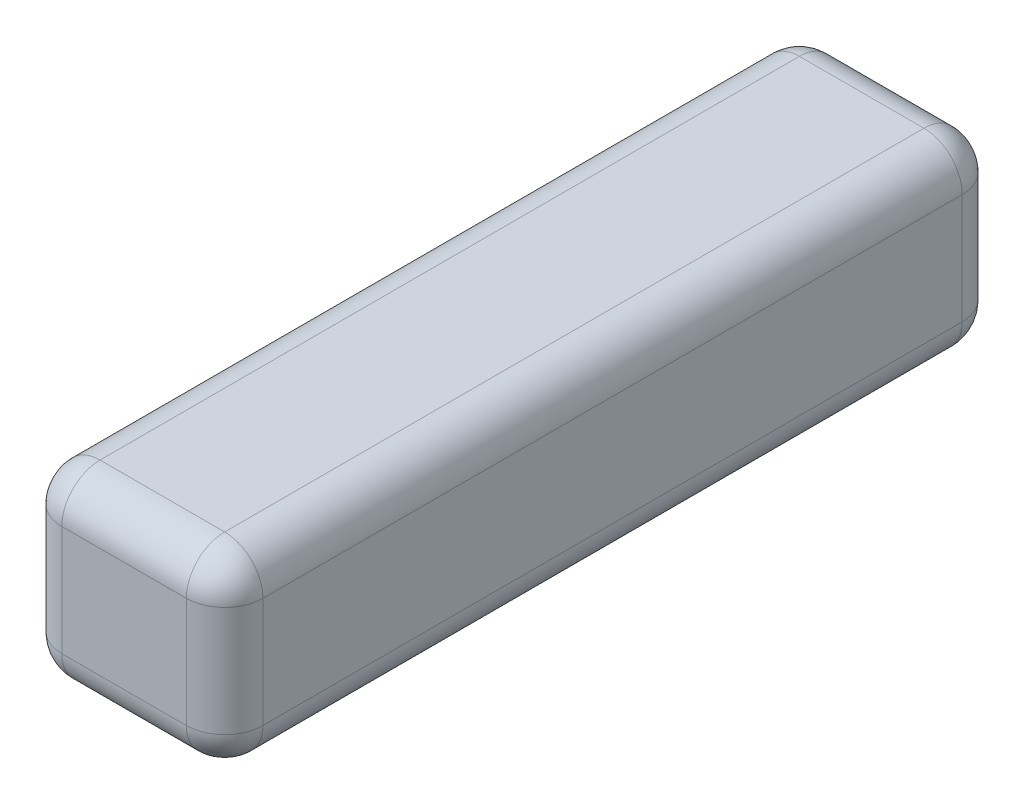
from build123d import *

# Parameters (mm, degrees)
SKETCH1_W           = 26.67
SKETCH1_H           = 24.765
BOSS_EXTRUDE1_DEPTH = 102.87
FILLET1_R           = 5.08
SKETCH2_W           = 11.43
SKETCH2_H           = 4.445
CUT_EXTRUDE1_DEPTH  = 12.7


with BuildPart() as part:
    # Sketch1 → Boss-Extrude1 (new body)
    with BuildSketch(Plane.XY):
        Rectangle(SKETCH1_W, SKETCH1_H)
    extrude(amount=BOSS_EXTRUDE1_DEPTH)

    # Fillet1
    fillet1_edges = [part.edges().sort_by_distance(p)[0] for p in [
        (13.335, 0, 102.87),
        (0, 12.3825, 102.87),
        (-13.335, 0, 102.87),
        (0, 12.3825, 0),
        (13.335, 0, 0),
        (0, -12.3825, 0),
        (-13.335, 0, 0),
        (-13.335, 12.3825, 51.435),
        (13.335, 12.3825, 51.435),
        (13.335, -12.3825, 51.435),
        (-13.335, -12.3825, 51.435),
        (0, -12.3825, 102.87),
    ]]
    fillet(fillet1_edges, radius=FILLET1_R)

    # Sketch2 → Cut-Extrude1 (cut)
    with BuildSketch(Plane(origin=(0, 0, 0), x_dir=(-1, 0, 0), z_dir=(0, 0, -1))):
        with Locations((0, -2.54)):
            Rectangle(SKETCH2_W, SKETCH2_H)
        Polygon((-2.54, 2.2225), (2.54, 2.2225), (3.4925, 3.4925), (3.4925, 4.7625), (-3.4925, 4.7625), (-3.4925, 3.4925), align=None)
    extrude(amount=-CUT_EXTRUDE1_DEPTH, mode=Mode.SUBTRACT)


solid = part.part
